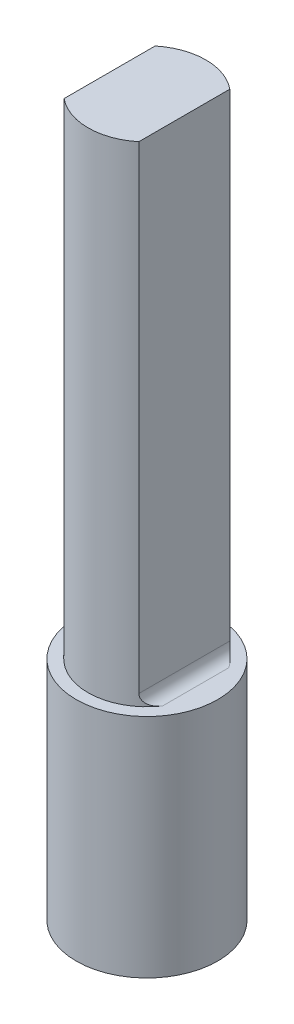
from build123d import *

# Parameters (mm, degrees)
SKETCH1_R           = 3.125
BOSS_EXTRUDE1_DEPTH = 5
BOSS_EXTRUDE2_DEPTH = 21.6
FILLET1_R           = 0.5


with BuildPart() as part:
    # Sketch1 → Boss-Extrude1 (new, symmetric)
    with BuildSketch(Plane(origin=(0, 0, 0), x_dir=(1, 0, 0), z_dir=(0, 1, 0))):
        with Locations(Location((0, 0, 0), (0, 0, 270))):
            Circle(SKETCH1_R)
    extrude(amount=BOSS_EXTRUDE1_DEPTH, both=True)

    # Sketch2 → Boss-Extrude2 (add)
    with BuildSketch(Plane(origin=(0, 5, 0), x_dir=(1, 0, 0), z_dir=(0, 1, 0))):
        with BuildLine():
            Line((-1.65, -2.00935313), (-1.65, 2.00935313))
            ThreePointArc((-1.65, 2.00935313), (0, 2.6), (1.65, 2.00935313))
            Line((1.65, 2.00935313), (1.65, -2.00935313))
            ThreePointArc((1.65, -2.00935313), (0, -2.6), (-1.65, -2.00935313))
        make_face()
    extrude(amount=BOSS_EXTRUDE2_DEPTH)

    # Fillet1
    fillet1_edges = [part.edges().sort_by_distance(p)[0] for p in [
        (1.65, 5, 0),
        (-1.65, 5, 0),
    ]]
    fillet(fillet1_edges, radius=FILLET1_R)


solid = part.part
